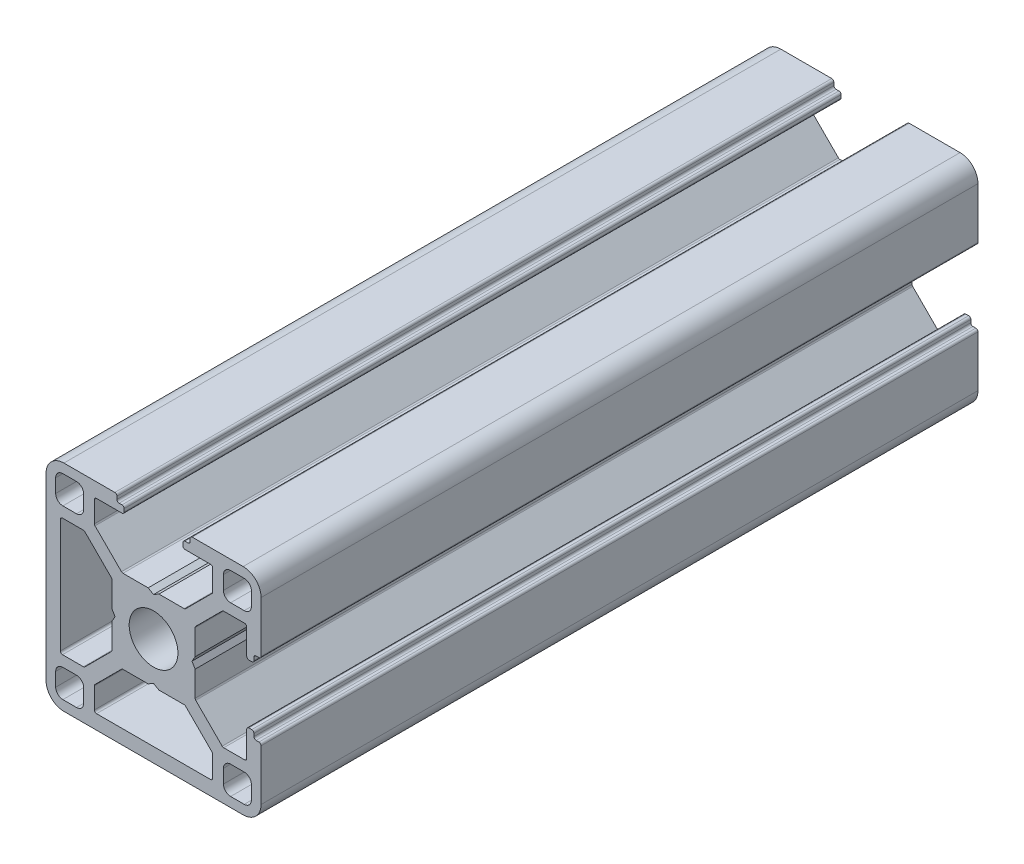
from build123d import *

# Parameters (mm, degrees)
SKETCH_1_R      = 3.4
EXTRUDE_1_DEPTH = 100


with BuildPart() as part:
    # 草图1 → 凸台-拉伸1 (new body)
    with BuildSketch(Plane.XY):
        with BuildLine():
            Line((5.859616846, 16.034137905), (12.959616847, 16.034137905))
            ThreePointArc((12.959616847, 16.034137905), (14.7273838, 15.301904858), (15.459616847, 13.534137905))
            Line((15.459616847, 13.534137905), (15.459616847, 6.434137905))
            ThreePointArc((15.459616847, 6.434137905), (15.371748881, 6.222005871), (15.159616847, 6.134137905))
            Line((15.159616847, 6.134137905), (14.759616847, 6.134137905))
            ThreePointArc((14.759616847, 6.134137905), (14.547484812, 6.046269939), (14.459616847, 5.834137905))
            Line((14.459616847, 5.834137905), (14.459616847, 5.434137905))
            ThreePointArc((14.459616847, 5.434137905), (14.371748881, 5.222005871), (14.159616847, 5.134137905))
            Line((14.159616847, 5.134137905), (13.759616847, 5.134137905))
            ThreePointArc((13.759616847, 5.134137905), (13.547484812, 5.222005871), (13.459616847, 5.434137905))
            Line((13.459616847, 5.434137905), (13.459616847, 8.984137905))
            ThreePointArc((13.459616847, 8.984137905), (13.371748881, 9.196269939), (13.159616847, 9.284137905))
            Line((13.159616847, 9.284137905), (10.248094478, 9.284137905))
            ThreePointArc((10.248094478, 9.284137905), (10.133289448, 9.261301765), (10.035962443, 9.196269939))
            Line((10.035962443, 9.196269939), (6.347484812, 5.507792308))
            ThreePointArc((6.347484812, 5.507792308), (6.282452987, 5.410465304), (6.259616847, 5.295660274))
            Line((6.259616847, 5.295660274), (6.259616847, 1.784137905))
            Line((6.259616847, 1.784137905), (5.826604145, 1.034137905))
            Line((5.826604145, 1.034137905), (6.259616847, 0.284137905))
            Line((6.259616847, 0.284137905), (6.259616847, -3.227384464))
            ThreePointArc((6.259616847, -3.227384464), (6.282452987, -3.342189494), (6.347484812, -3.439516498))
            Line((6.347484812, -3.439516498), (10.035962443, -7.127994129))
            ThreePointArc((10.035962443, -7.127994129), (10.133289448, -7.193025955), (10.248094478, -7.215862095))
            Line((10.248094478, -7.215862095), (13.159616847, -7.215862095))
            ThreePointArc((13.159616847, -7.215862095), (13.371748881, -7.127994129), (13.459616847, -6.915862095))
            Line((13.459616847, -6.915862095), (13.459616847, -3.365862095))
            ThreePointArc((13.459616847, -3.365862095), (13.547484812, -3.153730061), (13.759616847, -3.065862095))
            Line((13.759616847, -3.065862095), (14.159616847, -3.065862095))
            ThreePointArc((14.159616847, -3.065862095), (14.371748881, -3.153730061), (14.459616847, -3.365862095))
            Line((14.459616847, -3.365862095), (14.459616847, -3.765862095))
            ThreePointArc((14.459616847, -3.765862095), (14.547484812, -3.977994129), (14.759616847, -4.065862095))
            Line((14.759616847, -4.065862095), (15.159616847, -4.065862095))
            ThreePointArc((15.159616847, -4.065862095), (15.371748881, -4.153730061), (15.459616847, -4.365862095))
            Line((15.459616847, -4.365862095), (15.459616847, -11.465862095))
            ThreePointArc((15.459616847, -11.465862095), (14.7273838, -13.233629048), (12.959616847, -13.965862095))
            Line((12.959616847, -13.965862095), (-12.040383153, -13.965862095))
            ThreePointArc((-12.040383153, -13.965862095), (-13.808150106, -13.233629048), (-14.540383153, -11.465862095))
            Line((-14.540383153, -11.465862095), (-14.540383153, 13.534137905))
            ThreePointArc((-14.540383153, 13.534137905), (-13.808150106, 15.301904858), (-12.040383153, 16.034137905))
            Line((-12.040383153, 16.034137905), (-4.940383153, 16.034137905))
            ThreePointArc((-4.940383153, 16.034137905), (-4.728251119, 15.94626994), (-4.640383153, 15.734137905))
            Line((-4.640383153, 15.734137905), (-4.640383153, 15.334137905))
            ThreePointArc((-4.640383153, 15.334137905), (-4.552515188, 15.122005871), (-4.340383153, 15.034137905))
            Line((-4.340383153, 15.034137905), (-3.940383153, 15.034137905))
            ThreePointArc((-3.940383153, 15.034137905), (-3.728251119, 14.946269939), (-3.640383153, 14.734137905))
            Line((-3.640383153, 14.734137905), (-3.640383153, 14.334137905))
            ThreePointArc((-3.640383153, 14.334137905), (-3.728251119, 14.122005871), (-3.940383153, 14.034137905))
            Line((-3.940383153, 14.034137905), (-7.490383153, 14.034137905))
            ThreePointArc((-7.490383153, 14.034137905), (-7.702515188, 13.946269939), (-7.790383153, 13.734137905))
            Line((-7.790383153, 13.734137905), (-7.790383153, 10.822615536))
            ThreePointArc((-7.790383153, 10.822615536), (-7.767547013, 10.707810506), (-7.702515188, 10.610483502))
            Line((-7.702515188, 10.610483502), (-4.014037557, 6.922005871))
            ThreePointArc((-4.014037557, 6.922005871), (-3.916710552, 6.856974045), (-3.801905522, 6.834137905))
            Line((-3.801905522, 6.834137905), (-0.290383153, 6.834137905))
            Line((-0.290383153, 6.834137905), (0.459616847, 6.401125203))
            Line((0.459616847, 6.401125203), (1.209616847, 6.834137905))
            Line((1.209616847, 6.834137905), (4.721139216, 6.834137905))
            ThreePointArc((4.721139216, 6.834137905), (4.835944245, 6.856974045), (4.93327125, 6.922005871))
            Line((4.93327125, 6.922005871), (8.621748881, 10.610483502))
            ThreePointArc((8.621748881, 10.610483502), (8.686780706, 10.707810507), (8.709616847, 10.822615536))
            Line((8.709616847, 10.822615536), (8.709616847, 13.734137905))
            ThreePointArc((8.709616847, 13.734137905), (8.621748881, 13.946269939), (8.409616847, 14.034137905))
            Line((8.409616847, 14.034137905), (4.859616847, 14.034137905))
            ThreePointArc((4.859616847, 14.034137905), (4.647484812, 14.122005871), (4.559616847, 14.334137905))
            Line((4.559616847, 14.334137905), (4.559616847, 14.734137905))
            ThreePointArc((4.559616847, 14.734137905), (4.647484812, 14.946269939), (4.859616847, 15.034137905))
            Line((4.859616847, 15.034137905), (5.259616847, 15.034137905))
            ThreePointArc((5.259616847, 15.034137905), (5.471748881, 15.122005871), (5.559616847, 15.334137905))
            Line((5.559616847, 15.334137905), (5.559616847, 15.734137905))
            ThreePointArc((5.559616847, 15.734137905), (5.647484812, 15.94626994), (5.859616846, 16.034137905))
        make_face()
        with Locations((0.459616847, 1.034137905)):
            Circle(SKETCH_1_R, mode=Mode.SUBTRACT)
        with BuildLine():
            Line((8.409616847, -11.965862095), (-7.490383153, -11.965862095))
            ThreePointArc((-7.490383153, -11.965862095), (-7.702515188, -11.877994129), (-7.790383153, -11.665862095))
            Line((-7.790383153, -11.665862095), (-7.790383153, -8.754339726))
            ThreePointArc((-7.790383153, -8.754339726), (-7.767547013, -8.639534696), (-7.702515188, -8.542207692))
            Line((-7.702515188, -8.542207692), (-4.014037557, -4.853730061))
            ThreePointArc((-4.014037557, -4.853730061), (-3.916710552, -4.788698235), (-3.801905522, -4.765862095))
            Line((-3.801905522, -4.765862095), (-0.290383153, -4.765862095))
            Line((-0.290383153, -4.765862095), (0.459616847, -4.332849393))
            Line((0.459616847, -4.332849393), (1.209616847, -4.765862095))
            Line((1.209616847, -4.765862095), (4.721139216, -4.765862095))
            ThreePointArc((4.721139216, -4.765862095), (4.835944245, -4.788698235), (4.93327125, -4.853730061))
            Line((4.93327125, -4.853730061), (8.621748881, -8.542207692))
            ThreePointArc((8.621748881, -8.542207692), (8.686780706, -8.639534696), (8.709616847, -8.754339726))
            Line((8.709616847, -8.754339726), (8.709616847, -11.665862095))
            ThreePointArc((8.709616847, -11.665862095), (8.621748881, -11.877994129), (8.409616847, -11.965862095))
        make_face(mode=Mode.SUBTRACT)
        with BuildLine():
            Line((-10.290383153, -8.715862095), (-12.190383153, -8.715862095))
            ThreePointArc((-12.190383153, -8.715862095), (-12.897489934, -9.008755314), (-13.190383153, -9.715862095))
            Line((-13.190383153, -9.715862095), (-13.190383153, -11.615862095))
            ThreePointArc((-13.190383153, -11.615862095), (-12.897489934, -12.322968876), (-12.190383153, -12.615862095))
            Line((-12.190383153, -12.615862095), (-10.290383153, -12.615862095))
            ThreePointArc((-10.290383153, -12.615862095), (-9.583276372, -12.322968876), (-9.290383153, -11.615862095))
            Line((-9.290383153, -11.615862095), (-9.290383153, -9.715862095))
            ThreePointArc((-9.290383153, -9.715862095), (-9.583276372, -9.008755314), (-10.290383153, -8.715862095))
        make_face(mode=Mode.SUBTRACT)
        with BuildLine():
            Line((-9.290383153, 13.684137905), (-9.290383153, 11.784137905))
            ThreePointArc((-9.290383153, 11.784137905), (-9.583276372, 11.077031124), (-10.290383153, 10.784137905))
            Line((-10.290383153, 10.784137905), (-12.190383153, 10.784137905))
            ThreePointArc((-12.190383153, 10.784137905), (-12.897489934, 11.077031124), (-13.190383153, 11.784137905))
            Line((-13.190383153, 11.784137905), (-13.190383153, 13.684137905))
            ThreePointArc((-13.190383153, 13.684137905), (-12.897489934, 14.391244686), (-12.190383153, 14.684137905))
            Line((-12.190383153, 14.684137905), (-10.290383153, 14.684137905))
            ThreePointArc((-10.290383153, 14.684137905), (-9.583276372, 14.391244686), (-9.290383153, 13.684137905))
        make_face(mode=Mode.SUBTRACT)
        with BuildLine():
            Line((13.109616847, 10.784137905), (11.209616847, 10.784137905))
            ThreePointArc((11.209616847, 10.784137905), (10.502510066, 11.077031124), (10.209616847, 11.784137905))
            Line((10.209616847, 11.784137905), (10.209616847, 13.684137905))
            ThreePointArc((10.209616847, 13.684137905), (10.502510066, 14.391244686), (11.209616847, 14.684137905))
            Line((11.209616847, 14.684137905), (13.109616847, 14.684137905))
            ThreePointArc((13.109616847, 14.684137905), (13.816723628, 14.391244686), (14.109616847, 13.684137905))
            Line((14.109616847, 13.684137905), (14.109616847, 11.784137905))
            ThreePointArc((14.109616847, 11.784137905), (13.816723628, 11.077031124), (13.109616847, 10.784137905))
        make_face(mode=Mode.SUBTRACT)
        with BuildLine():
            Line((-5.340383153, 5.295660274), (-5.340383153, 1.784137905))
            Line((-5.340383153, 1.784137905), (-4.907370451, 1.034137905))
            Line((-4.907370451, 1.034137905), (-5.340383153, 0.284137905))
            Line((-5.340383153, 0.284137905), (-5.340383153, -3.227384464))
            ThreePointArc((-5.340383153, -3.227384464), (-5.363219294, -3.342189494), (-5.428251119, -3.439516498))
            Line((-5.428251119, -3.439516498), (-9.11672875, -7.127994129))
            ThreePointArc((-9.11672875, -7.127994129), (-9.214055755, -7.193025955), (-9.328860784, -7.215862095))
            Line((-9.328860784, -7.215862095), (-12.240383153, -7.215862095))
            ThreePointArc((-12.240383153, -7.215862095), (-12.452515188, -7.127994129), (-12.540383153, -6.915862095))
            Line((-12.540383153, -6.915862095), (-12.540383153, 8.984137905))
            ThreePointArc((-12.540383153, 8.984137905), (-12.452515188, 9.196269939), (-12.240383153, 9.284137905))
            Line((-12.240383153, 9.284137905), (-9.328860784, 9.284137905))
            ThreePointArc((-9.328860784, 9.284137905), (-9.214055755, 9.261301765), (-9.11672875, 9.196269939))
            Line((-9.11672875, 9.196269939), (-5.428251119, 5.507792308))
            ThreePointArc((-5.428251119, 5.507792308), (-5.363219294, 5.410465304), (-5.340383153, 5.295660274))
        make_face(mode=Mode.SUBTRACT)
        with BuildLine():
            Line((14.109616847, -11.615862095), (14.109616847, -9.715862095))
            ThreePointArc((14.109616847, -9.715862095), (13.816723628, -9.008755314), (13.109616847, -8.715862095))
            Line((13.109616847, -8.715862095), (11.209616847, -8.715862095))
            ThreePointArc((11.209616847, -8.715862095), (10.502510066, -9.008755314), (10.209616847, -9.715862095))
            Line((10.209616847, -9.715862095), (10.209616847, -11.615862095))
            ThreePointArc((10.209616847, -11.615862095), (10.502510066, -12.322968876), (11.209616847, -12.615862095))
            Line((11.209616847, -12.615862095), (13.109616847, -12.615862095))
            ThreePointArc((13.109616847, -12.615862095), (13.816723628, -12.322968876), (14.109616847, -11.615862095))
        make_face(mode=Mode.SUBTRACT)
    extrude(amount=EXTRUDE_1_DEPTH)


solid = part.part
